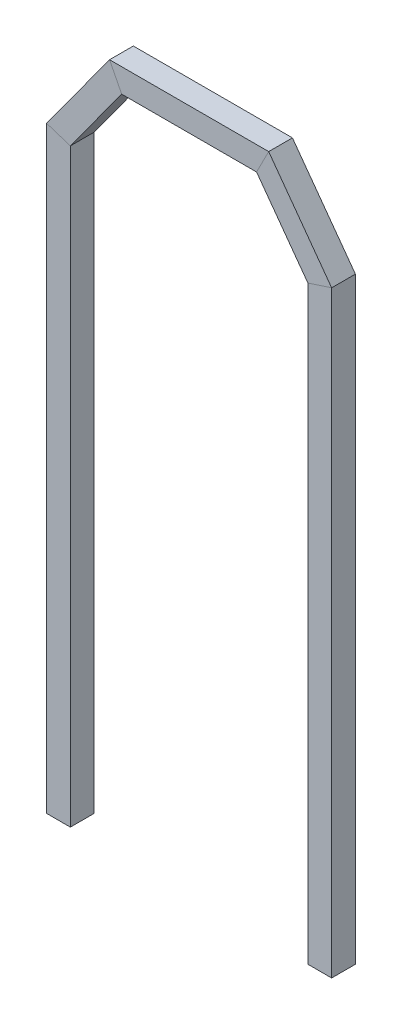
from build123d import *

# Parameters (mm, degrees)
SKETCH2_W   = 60
SKETCH2_H   = 60
SKETCH2_W_2 = 50
SKETCH2_H_2 = 50


with BuildPart() as part:
    # Sweep1: sweep along a path in Sketch1
    with BuildLine(Plane.XY) as sweep1_path:
        Line((330, 0), (330, 1500))
        Line((330, 1500), (185.671137026, 1698.283381924))
        Line((185.671137026, 1698.283381924), (0, 1698.283381924))
    # Sketch2 → Sweep1 (sweep)
    with BuildSketch(Plane(origin=(0, 0, 0), x_dir=(1, 0, 0), z_dir=(0, 1, 0))):
        with Locations((330, 0)):
            Rectangle(SKETCH2_W, SKETCH2_H)
        with Locations((330, 0)):
            Rectangle(SKETCH2_W_2, SKETCH2_H_2, mode=Mode.SUBTRACT)
    sweep1 = sweep(path=sweep1_path.line, transition=Transition.RIGHT)

    # Mirror1: Sweep1 across plane
    add(sweep1.mirror(Plane(origin=(0, 0, 0), x_dir=(0, 0, 1), z_dir=(1, 0, 0))))


solid = part.part
